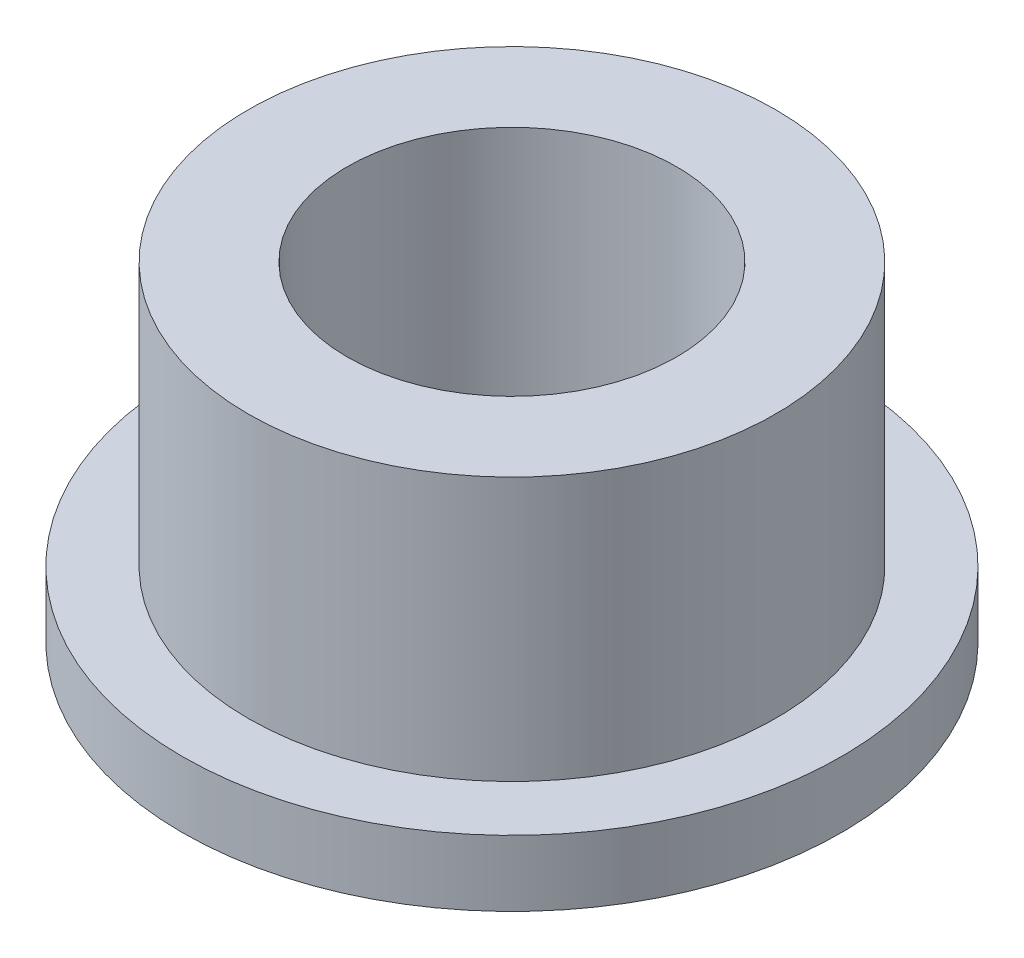
from build123d import *

# Parameters (mm, degrees)
SKETCH1_R           = 5
BOSS_EXTRUDE1_DEPTH = 1
SKETCH2_R           = 4
BOSS_EXTRUDE4_DEPTH = 4
SKETCH5_R           = 2.5
CUT_EXTRUDE4_DEPTH  = 4
SKETCH6_R           = 1.25
CUT_EXTRUDE5_DEPTH  = 4
SKETCH7_R           = 1.5
CUT_EXTRUDE6_DEPTH  = 10


with BuildPart() as part:
    # Sketch1 → Boss-Extrude1 (new body)
    with BuildSketch(Plane(origin=(0, 0, 0), x_dir=(1, 0, 0), z_dir=(0, 1, 0))):
        with Locations(Location((0, 0, 0), (0, 0, 270))):
            Circle(SKETCH1_R)
    extrude(amount=BOSS_EXTRUDE1_DEPTH)

    # Sketch2 → Boss-Extrude4 (add)
    with BuildSketch(Plane(origin=(0, 1, 0), x_dir=(1, 0, 0), z_dir=(0, 1, 0))):
        with Locations(Location((0, 0, 0), (0, 0, 270))):
            Circle(SKETCH2_R)
    extrude(amount=BOSS_EXTRUDE4_DEPTH)

    # Sketch5 → Cut-Extrude4 (cut)
    with BuildSketch(Plane(origin=(0, 5, 0), x_dir=(1, 0, 0), z_dir=(0, 1, 0))):
        with Locations(Location((0, 0, 0), (0, 0, 270))):
            Circle(SKETCH5_R)
    extrude(amount=-CUT_EXTRUDE4_DEPTH, mode=Mode.SUBTRACT)

    # Sketch6 → Cut-Extrude5 (cut)
    with BuildSketch(Plane(origin=(0, 1, 0), x_dir=(1, 0, 0), z_dir=(0, 1, 0))):
        with Locations(Location((0, 0, 0), (0, 0, 270))):
            Circle(SKETCH6_R)
    extrude(amount=-CUT_EXTRUDE5_DEPTH, mode=Mode.SUBTRACT)

    # Sketch7 → Cut-Extrude6 (cut)
    with BuildSketch(Plane.XZ):
        with Locations(Location((0, 0, 0), (0, 0, 270))):
            Circle(SKETCH7_R)
    extrude(amount=-CUT_EXTRUDE6_DEPTH, mode=Mode.SUBTRACT)


solid = part.part
